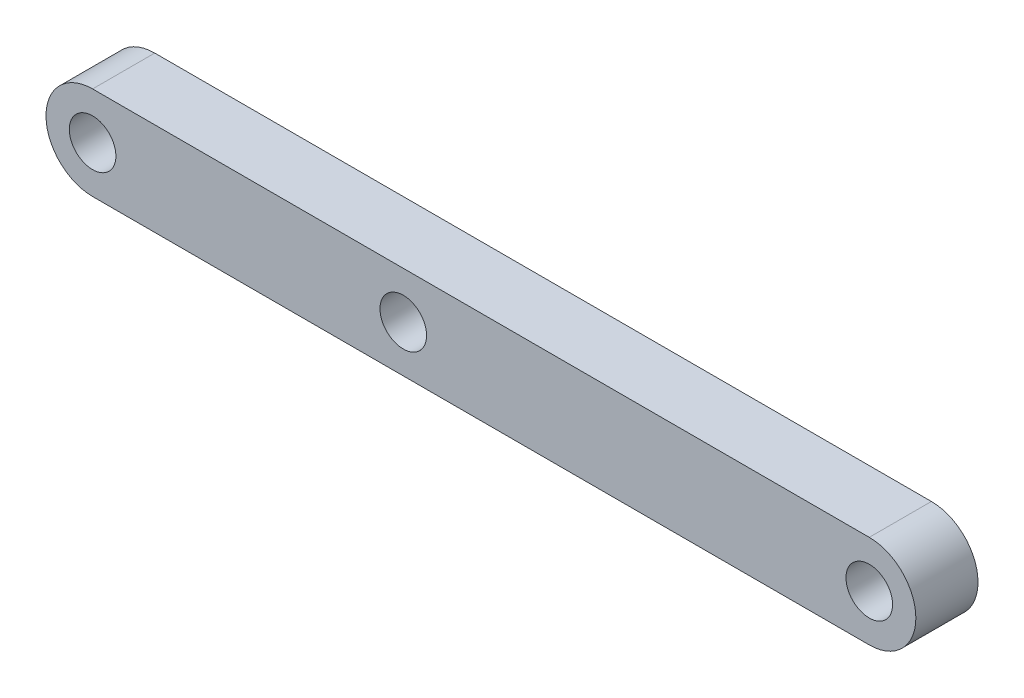
from build123d import *

# Parameters (mm, degrees)
SKETCH1_R           = 1.5
BOSS_EXTRUDE1_DEPTH = 4


with BuildPart() as part:
    # Sketch1 → Boss-Extrude1 (new body)
    with BuildSketch(Plane.XY):
        with BuildLine():
            Line((-25, 3), (25, 3))
            ThreePointArc((25, 3), (28, 0), (25, -3))
            Line((25, -3), (-25, -3))
            ThreePointArc((-25, -3), (-28, 0), (-25, 3))
        make_face()
        with Locations((-25, 0)):
            Circle(SKETCH1_R, mode=Mode.SUBTRACT)
        with Locations((25, 0)):
            Circle(SKETCH1_R, mode=Mode.SUBTRACT)
        with Locations((-5, 0)):
            Circle(SKETCH1_R, mode=Mode.SUBTRACT)
    extrude(amount=BOSS_EXTRUDE1_DEPTH)


solid = part.part
